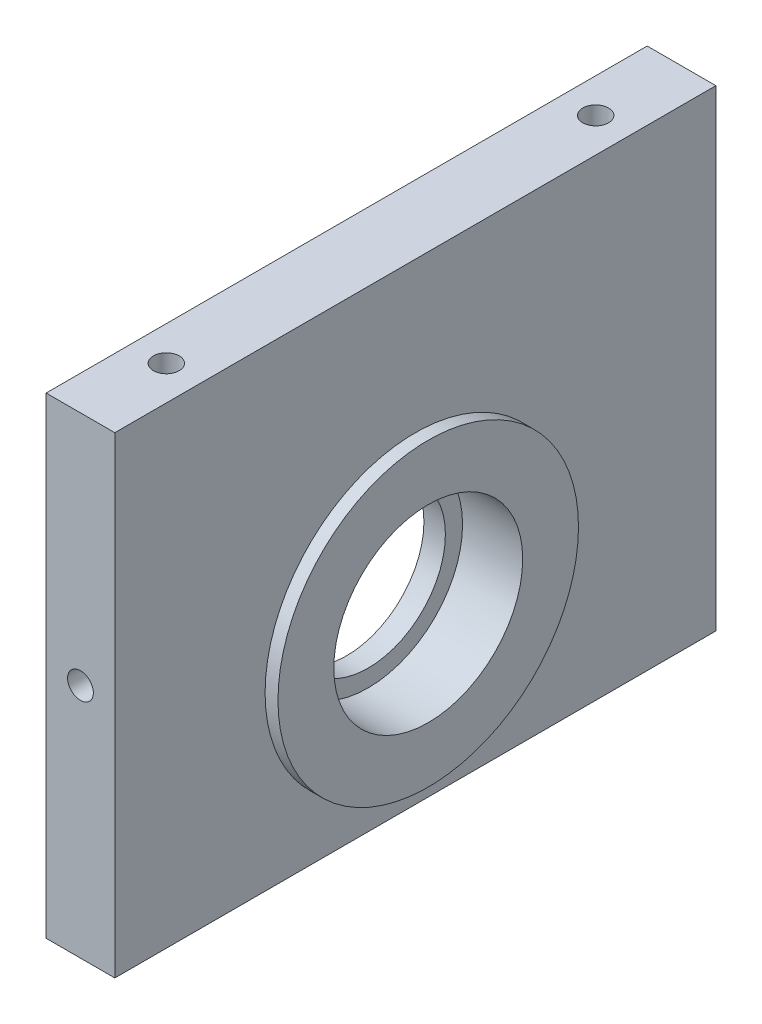
from build123d import *

# Parameters (mm, degrees)
ESQUISSE1_W               = 70
ESQUISSE1_H               = 55
ESQUISSE1_R               = 9
BOSS_EXTRU_1_DEPTH        = 4
ESQUISSE2_R               = 11
ENL_V_MAT_EXTRU_1_DEPTH   = 5.5
TROU_TARAUD_M4X0_71_D     = 3
TROU_TARAUD_M4X0_71_DEPTH = 15
TROU_TARAUD_M4X0_71_TIP   = 0.901290929
TROU_TARAUD_M4X0_72_D     = 3
TROU_TARAUD_M4X0_72_DEPTH = 15
TROU_TARAUD_M4X0_72_TIP   = 0.901290929
TROU_TARAUD_M4X0_73_D     = 3
TROU_TARAUD_M4X0_73_DEPTH = 15
TROU_TARAUD_M4X0_73_TIP   = 0.901290929
TROU_TARAUD_M4X0_74_D     = 3
TROU_TARAUD_M4X0_74_DEPTH = 15
TROU_TARAUD_M4X0_74_TIP   = 0.901290929
BOSS_EXTRU_2_START        = 7
ESQUISSE11_R              = 17.5
ESQUISSE11_R_2            = 11
BOSS_EXTRU_2_DEPTH        = 7


with BuildPart() as part:
    # Esquisse1 → Boss.-Extru.1 (new, symmetric)
    with BuildSketch(Plane(origin=(0, 0, 0), x_dir=(0, 0, -1), z_dir=(1, 0, 0))):
        with Locations((0, 7.5)):
            Rectangle(ESQUISSE1_W, ESQUISSE1_H)
        Circle(ESQUISSE1_R, mode=Mode.SUBTRACT)
    extrude(amount=BOSS_EXTRU_1_DEPTH, both=True)

    # Esquisse2 → Enlèv. mat.-Extru.1 (cut)
    with BuildSketch(Plane(origin=(4, 0, 0), x_dir=(0, 0, -1), z_dir=(1, 0, 0))):
        Circle(ESQUISSE2_R)
    extrude(amount=-ENL_V_MAT_EXTRU_1_DEPTH, mode=Mode.SUBTRACT)

    # Trou taraudé M4x0.71
    with Locations(Plane(origin=(0, -20, 0), x_dir=(-1, 0, 0), z_dir=(0, -1, 0))):
        with Locations((0, -25), (0, 25)):
            Hole(TROU_TARAUD_M4X0_71_D / 2, depth=TROU_TARAUD_M4X0_71_DEPTH)
            with Locations((0, 0, -(TROU_TARAUD_M4X0_71_DEPTH + TROU_TARAUD_M4X0_71_TIP / 2))):  # 118° drill point
                Cone(0, TROU_TARAUD_M4X0_71_D / 2, TROU_TARAUD_M4X0_71_TIP, mode=Mode.SUBTRACT)

    # Trou taraudé M4x0.72
    with Locations(Plane(origin=(0, 35, 0), x_dir=(1, 0, 0), z_dir=(0, 1, 0))):
        with Locations((0, -25), (0, 25)):
            Hole(TROU_TARAUD_M4X0_72_D / 2, depth=TROU_TARAUD_M4X0_72_DEPTH)
            with Locations((0, 0, -(TROU_TARAUD_M4X0_72_DEPTH + TROU_TARAUD_M4X0_72_TIP / 2))):  # 118° drill point
                Cone(0, TROU_TARAUD_M4X0_72_D / 2, TROU_TARAUD_M4X0_72_TIP, mode=Mode.SUBTRACT)

    # Trou taraudé M4x0.73
    with Locations(Plane.XY.offset(35)):
        with Locations((0, 7.5)):
            Hole(TROU_TARAUD_M4X0_73_D / 2, depth=TROU_TARAUD_M4X0_73_DEPTH)
            with Locations((0, 0, -(TROU_TARAUD_M4X0_73_DEPTH + TROU_TARAUD_M4X0_73_TIP / 2))):  # 118° drill point
                Cone(0, TROU_TARAUD_M4X0_73_D / 2, TROU_TARAUD_M4X0_73_TIP, mode=Mode.SUBTRACT)

    # Trou taraudé M4x0.74
    with Locations(Plane(origin=(0, 0, -35), x_dir=(-1, 0, 0), z_dir=(0, 0, -1))):
        with Locations((0, 7.5)):
            Hole(TROU_TARAUD_M4X0_74_D / 2, depth=TROU_TARAUD_M4X0_74_DEPTH)
            with Locations((0, 0, -(TROU_TARAUD_M4X0_74_DEPTH + TROU_TARAUD_M4X0_74_TIP / 2))):  # 118° drill point
                Cone(0, TROU_TARAUD_M4X0_74_D / 2, TROU_TARAUD_M4X0_74_TIP, mode=Mode.SUBTRACT)

    # Esquisse11 → Boss.-Extru.2 (add)
    with BuildSketch(Plane(origin=(-1.5, 0, 0), x_dir=(0, 0, -1), z_dir=(1, 0, 0)).offset(BOSS_EXTRU_2_START)):
        with Locations(Location((0, 0, 0), (0, 0, 180))):
            Circle(ESQUISSE11_R)
        Circle(ESQUISSE11_R_2, mode=Mode.SUBTRACT)
    extrude(amount=-BOSS_EXTRU_2_DEPTH)


solid = part.part
